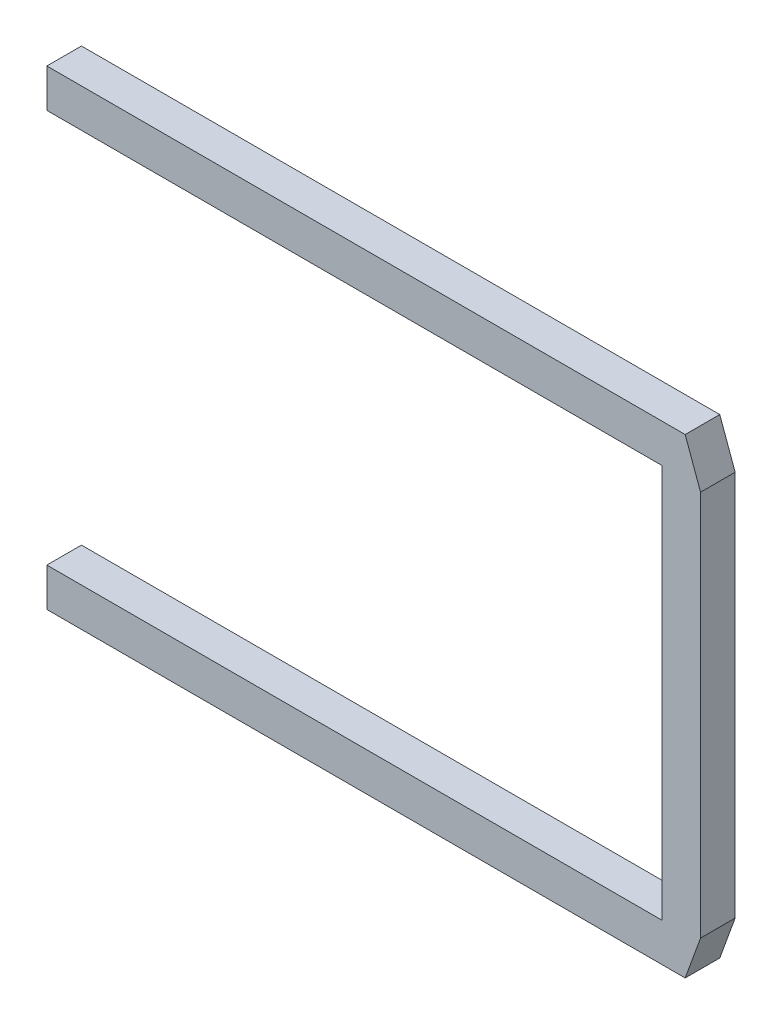
from build123d import *
from OCP.BRepFilletAPI import BRepFilletAPI_MakeChamfer

# Parameters (mm, degrees)
BOSS_EXTRUDE1_DEPTH = 4.5
CHAMFER1_SIZE       = 2
CHAMFER1_SIZE2      = 5.494954839


with BuildPart() as part:
    # Sketch1 → Boss-Extrude1 (new body)
    with BuildSketch(Plane.XY):
        Polygon((-42.5, -25.6), (-42.5, -30.6), (42.5, -30.6), (42.5, 30.6), (-42.5, 30.6), (-42.5, 25.6), (37.5, 25.6), (37.5, -25.6), align=None)
    extrude(amount=BOSS_EXTRUDE1_DEPTH)

    # Chamfer1: one chamfer whose edges measure the first distance from different faces: ONE call of the kernel's chamfer builder (chamfer() names one face for all edges)
    chamfer1_edges_1 = [part.edges().sort_by_distance(p)[0] for p in [
        (42.5, -30.6, 2.25),
    ]]
    chamfer1_side_1 = [part.faces().sort_by_distance(p)[0] for p in [
        (0, -30.6, 2.25),
    ]]
    chamfer1_edges_2 = [part.edges().sort_by_distance(p)[0] for p in [
        (42.5, 30.6, 2.25),
    ]]
    chamfer1_side_2 = [part.faces().sort_by_distance(p)[0] for p in [
        (0, 30.6, 2.25),
    ]]
    chamfer1 = BRepFilletAPI_MakeChamfer(part.part.solid().wrapped)
    for e in chamfer1_edges_1:
        chamfer1.Add(CHAMFER1_SIZE, CHAMFER1_SIZE2, e.wrapped, chamfer1_side_1[0].wrapped)  # the first distance lies on this face
    for e in chamfer1_edges_2:
        chamfer1.Add(CHAMFER1_SIZE, CHAMFER1_SIZE2, e.wrapped, chamfer1_side_2[0].wrapped)  # the first distance lies on this face
    add(Compound.cast(chamfer1.Shape()), mode=Mode.REPLACE)


solid = part.part
